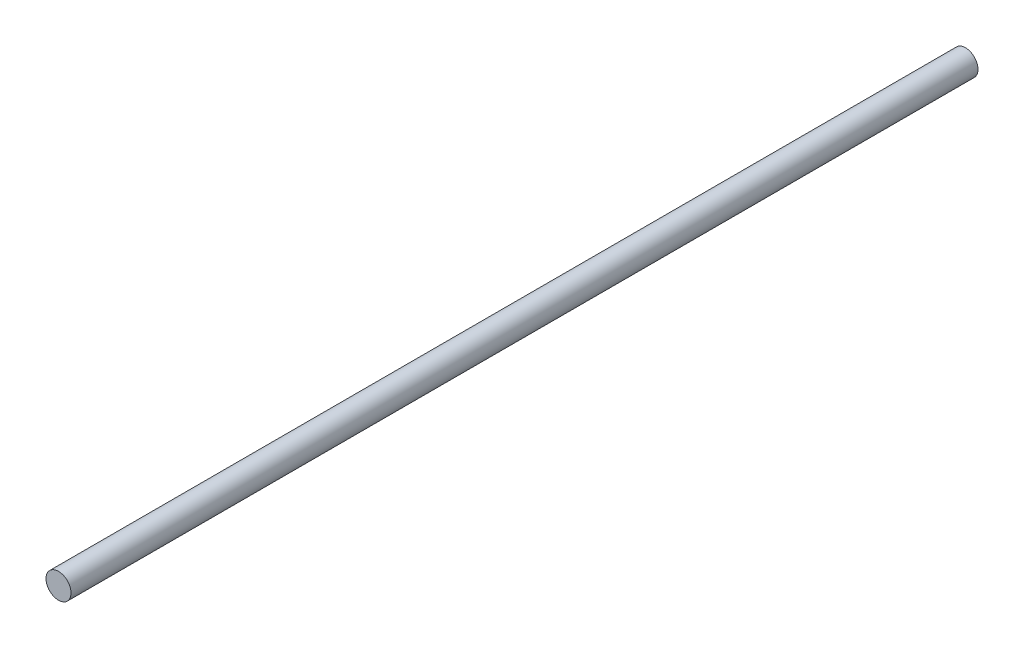
from build123d import *

# Parameters (mm, degrees)
BOSS_EXTRUDE1_DEPTH      = 115
BOSS_EXTRUDE1_DEPTH_BACK = 115
SKETCH2_R                = 3.175


with BuildPart() as part:
    # Sketch2 → Boss-Extrude1 (new, two sides: drawn at the far end of the back side and taken through both)
    with BuildSketch(Plane.XY.offset(-BOSS_EXTRUDE1_DEPTH_BACK)):
        Circle(SKETCH2_R)
    extrude(amount=BOSS_EXTRUDE1_DEPTH + BOSS_EXTRUDE1_DEPTH_BACK)


solid = part.part
